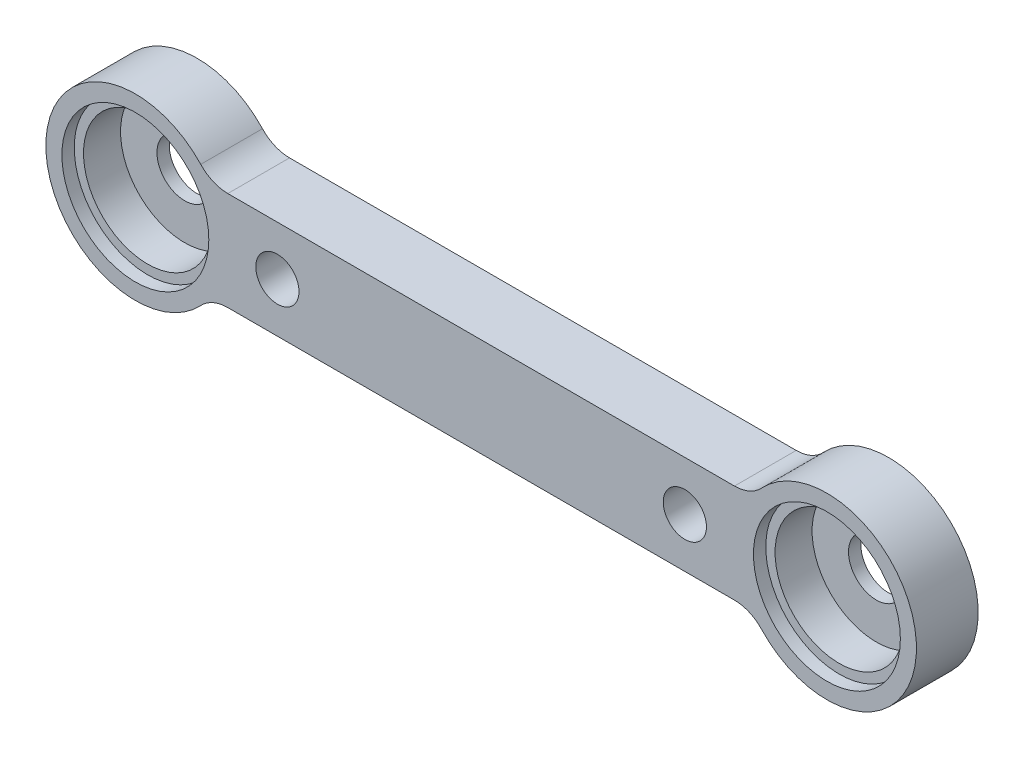
from build123d import *

# Parameters (mm, degrees)
SKETCH1_R           = 1.75
BOSS_EXTRUDE1_DEPTH = 5
SKETCH2_R           = 7.25
BOSS_EXTRUDE2_DEPTH = 5
SKETCH5_R           = 5.95
CUT_EXTRUDE2_DEPTH  = 1
SKETCH6_R           = 2.25
CUT_EXTRUDE3_DEPTH  = 4
FILLET1_R           = 3
SKETCH7_R           = 5.2
CUT_EXTRUDE4_DEPTH  = 3


with BuildPart() as part:
    # Sketch1 → Boss-Extrude1 (new body)
    with BuildSketch(Plane.XY):
        with BuildLine():
            Line((-68.758315939, 4), (-12.748315939, 4))
            ThreePointArc((-12.748315939, 4), (-8.748315939, 0), (-12.748315939, -4))
            Line((-12.748315939, -4), (-68.758315939, -4))
            ThreePointArc((-68.758315939, -4), (-72.758315939, 0), (-68.758315939, 4))
        make_face()
        with Locations((-57.253315939, 0)):
            Circle(SKETCH1_R, mode=Mode.SUBTRACT)
        with Locations(Location((-24.253315939, 0, 0), (0, 0, 180))):
            Circle(SKETCH1_R, mode=Mode.SUBTRACT)
    extrude(amount=BOSS_EXTRUDE1_DEPTH)

    # Sketch2 → Boss-Extrude2 (add)
    with BuildSketch(Plane(origin=(0, 0, 0), x_dir=(-1, 0, 0), z_dir=(0, 0, -1))):
        with Locations((68.758315939, 0)):
            Circle(SKETCH2_R)
        with Locations((12.748315939, 0)):
            Circle(SKETCH2_R)
    extrude(amount=-BOSS_EXTRUDE2_DEPTH)

    # Sketch5 → Cut-Extrude2 (cut)
    with BuildSketch(Plane.XY.offset(5)):
        with Locations((-68.758315939, 0)):
            Circle(SKETCH5_R)
        with Locations((-12.748315939, 0)):
            Circle(SKETCH5_R)
    extrude(amount=-CUT_EXTRUDE2_DEPTH, mode=Mode.SUBTRACT)

    # Sketch6 → Cut-Extrude3 (cut)
    with BuildSketch(Plane(origin=(0, 0, 0), x_dir=(-1, 0, 0), z_dir=(0, 0, -1))):
        with Locations((12.748315939, 0)):
            Circle(SKETCH6_R)
        with Locations(Location((68.758315939, 0, 0), (0, 0, 180))):
            Circle(SKETCH6_R)
    extrude(amount=-CUT_EXTRUDE3_DEPTH, mode=Mode.SUBTRACT)

    # Fillet1
    fillet1_edges = [part.edges().sort_by_distance(p)[0] for p in [
        (-62.711622628, 4, 2.5),
        (-62.711622628, -4, 2.5),
        (-18.79500925, 4, 2.5),
        (-18.79500925, -4, 2.5),
    ]]
    fillet(fillet1_edges, radius=FILLET1_R)

    # Sketch7 → Cut-Extrude4 (cut)
    with BuildSketch(Plane.XY.offset(4)):
        with Locations((-68.758315939, 0)):
            Circle(SKETCH7_R)
        with Locations((-12.748315939, 0)):
            Circle(SKETCH7_R)
    extrude(amount=-CUT_EXTRUDE4_DEPTH, mode=Mode.SUBTRACT)


solid = part.part
